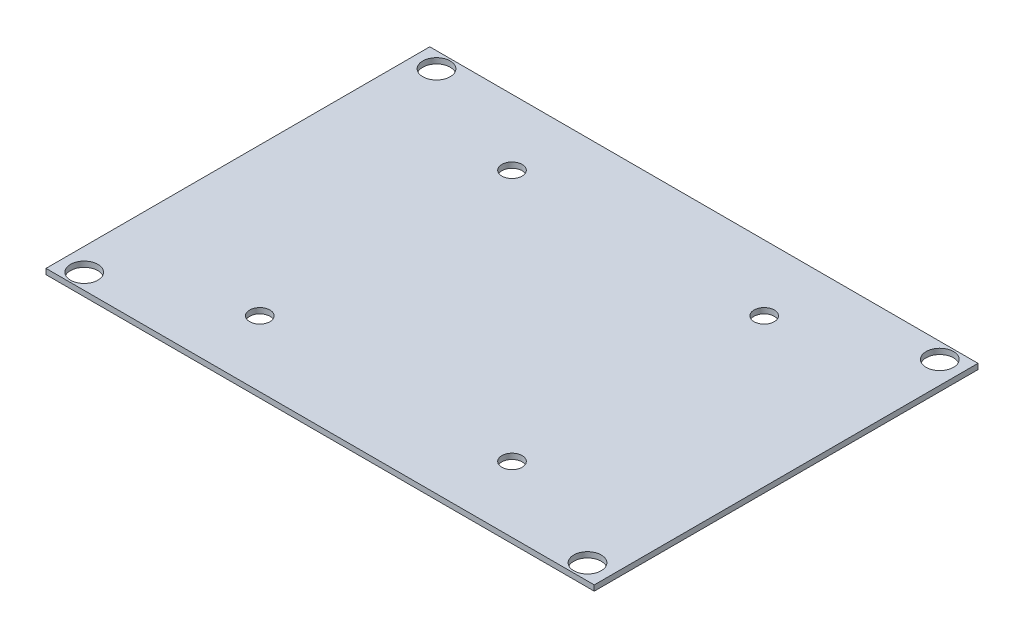
from build123d import *

# Parameters (mm, degrees)
CROQUIS4_W              = 100
CROQUIS4_H              = 70
CROQUIS4_R              = 1.85
CROQUIS4_R_2            = 2.5
SALIENTE_EXTRUIR3_DEPTH = 1


with BuildPart() as part:
    # Croquis4 → Saliente-Extruir3 (new body)
    with BuildSketch(Plane(origin=(0, 0, 0), x_dir=(1, 0, 0), z_dir=(0, 1, 0))):
        Rectangle(CROQUIS4_W, CROQUIS4_H)
        with Locations(Location((-23, 23, 0), (0, 0, 270))):
            Circle(CROQUIS4_R, mode=Mode.SUBTRACT)
        with Locations(Location((-23, -23, 0), (0, 0, 270))):
            Circle(CROQUIS4_R, mode=Mode.SUBTRACT)
        with Locations(Location((23, -23, 0), (0, 0, 270))):
            Circle(CROQUIS4_R, mode=Mode.SUBTRACT)
        with Locations(Location((23, 23, 0), (0, 0, 270))):
            Circle(CROQUIS4_R, mode=Mode.SUBTRACT)
        with Locations(Location((-45.903840397, 32.132688278, 0), (0, 0, 270))):
            Circle(CROQUIS4_R_2, mode=Mode.SUBTRACT)
        with Locations(Location((45.903840397, 32.132688278, 0), (0, 0, 270))):
            Circle(CROQUIS4_R_2, mode=Mode.SUBTRACT)
        with Locations(Location((45.903840397, -32.132688278, 0), (0, 0, 270))):
            Circle(CROQUIS4_R_2, mode=Mode.SUBTRACT)
        with Locations(Location((-45.903840397, -32.132688278, 0), (0, 0, 270))):
            Circle(CROQUIS4_R_2, mode=Mode.SUBTRACT)
    extrude(amount=SALIENTE_EXTRUIR3_DEPTH)


solid = part.part
